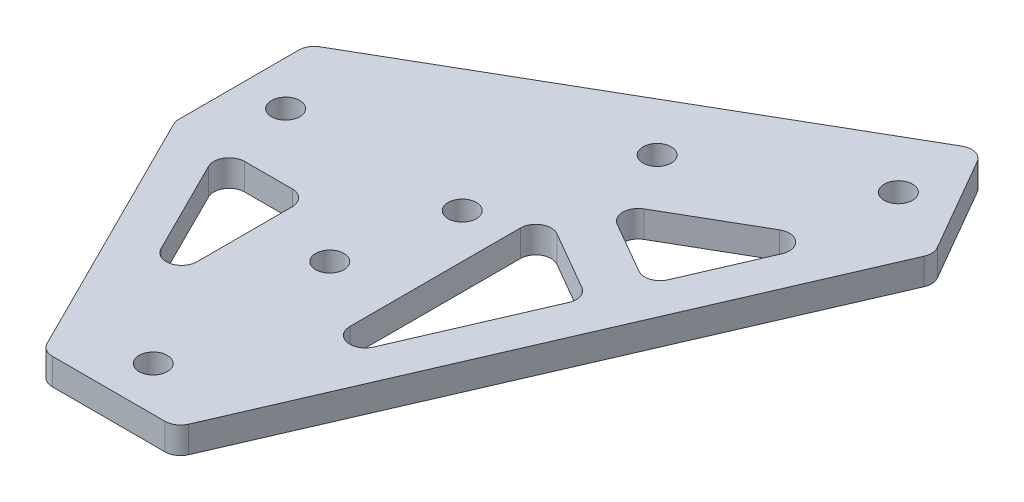
from build123d import *

# Parameters (mm, degrees)
SKETCH_4_R          = 1.6
EXTRUDE_1_DEPTH     = 1.5
CUT_EXTRUDE_2_DEPTH = 3
FILLET_2_R          = 1.75


with BuildPart() as part:
    # ｽｹｯﾁ4 → ﾎﾞｽ - 押し出し1 (new, symmetric)
    with BuildSketch(Plane(origin=(0, 0, 0), x_dir=(1, 0, 0), z_dir=(0, 1, 0))):
        Polygon((-30, 0), (-30, 15), (18.480762114, 42.990381057), (25.980762114, 30), (0, -30), (-15, -30), align=None)
        with Locations(Location((0.580127019, 23.995190528, 0), (0, 0, 270))):
            Circle(SKETCH_4_R, mode=Mode.SUBTRACT)
        with Locations(Location((-5, 7.5, 0), (0, 0, 270))):
            Circle(SKETCH_4_R, mode=Mode.SUBTRACT)
        with Locations(Location((-7.5, -5, 0), (0, 0, 270))):
            Circle(SKETCH_4_R, mode=Mode.SUBTRACT)
        with Locations(Location((-7.5, -25, 0), (0, 0, 270))):
            Circle(SKETCH_4_R, mode=Mode.SUBTRACT)
        with Locations(Location((-25, 7.5, 0), (0, 0, 270))):
            Circle(SKETCH_4_R, mode=Mode.SUBTRACT)
        with Locations(Location((17.900635095, 33.995190528, 0), (0, 0, 270))):
            Circle(SKETCH_4_R, mode=Mode.SUBTRACT)
    extrude(amount=EXTRUDE_1_DEPTH, both=True)

    # ｽｹｯﾁ5 → ｶｯﾄ - 押し出し2 (cut)
    with BuildSketch(Plane(origin=(0, 1.5, 0), x_dir=(1, 0, 0), z_dir=(0, 1, 0))):
        Polygon((12.665448219, 10.574351407), (19.442413698, 26.225082782), (6.92820323, 19), (4.714101615, 15.165063509), align=None)
        Polygon((4.714101615, 15.165063509), (6.92820323, 19), (2.5, 16.443375673), align=None)
        Polygon((2.214101615, 10.834936491), (0, 12.113248654), (0, 7), align=None)
        Polygon((0, 0), (0, -18.675248347), (10.665448219, 5.955549254), (2.214101615, 10.834936491), (0, 7), align=None)
        Polygon((-15, 0), (-24.968847051, 0), (-15, -19.937694101), align=None)
    extrude(amount=-CUT_EXTRUDE_2_DEPTH, mode=Mode.SUBTRACT)

    # ﾌｨﾚｯﾄ2
    fillet_2_edges = [part.edges().sort_by_distance(p)[0] for p in [
        (-30, 0, 0),
        (-30, 0, -15),
        (18.480762114, 0, -42.990381057),
        (25.980762114, 0, -30),
        (0, 0, 30),
        (-15, 0, 30),
        (-24.968847051, 0, 0),
        (-15, 0, 0),
        (-15, 0, 19.937694101),
        (0, 0, 18.675248347),
        (0, 0, -12.113248654),
        (10.665448219, 0, -5.955549254),
        (2.5, 0, -16.443375673),
        (19.442413698, 0, -26.225082782),
        (12.665448219, 0, -10.574351407),
    ]]
    fillet(fillet_2_edges, radius=FILLET_2_R)


solid = part.part
